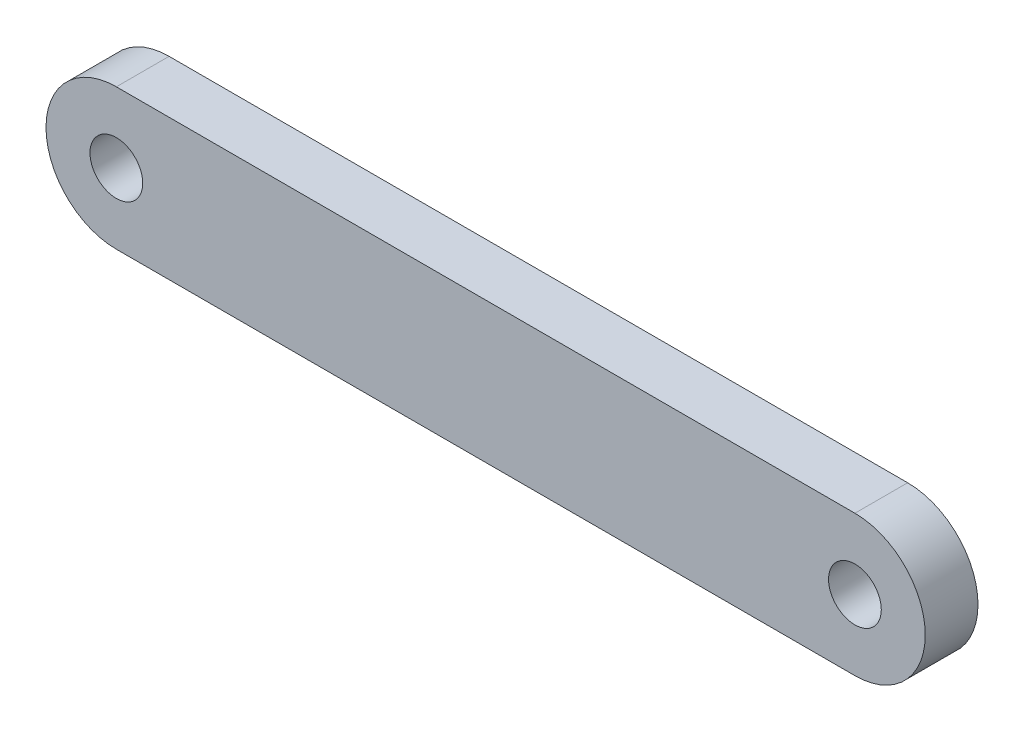
from build123d import *

# Parameters (mm, degrees)
BOSS_EXTRUDE1_DEPTH = 15
SKETCH4_R           = 7.5
CUT_EXTRUDE1_DEPTH  = 128.47548784


with BuildPart() as part:
    # Sketch1 → Boss-Extrude1 (new body)
    with BuildSketch(Plane.XY):
        with BuildLine():
            Line((-105, -20), (105, -20))
            ThreePointArc((105, -20), (125, 0), (105, 20))
            Line((105, 20), (-105, 20))
            ThreePointArc((-105, 20), (-125, 0), (-105, -20))
        make_face()
    extrude(amount=BOSS_EXTRUDE1_DEPTH)

    # Sketch4 → Cut-Extrude1 (cut, through all)
    with BuildSketch(Plane.XY.offset(15)):
        with Locations((105, 0)):
            Circle(SKETCH4_R)
    cut_extrude1 = extrude(amount=-CUT_EXTRUDE1_DEPTH, mode=Mode.SUBTRACT)

    # Mirror1: Cut-Extrude1 across plane
    add(cut_extrude1.mirror(Plane(origin=(0, 0, 0), x_dir=(0, 0, 1), z_dir=(1, 0, 0))), mode=Mode.SUBTRACT)


solid = part.part
